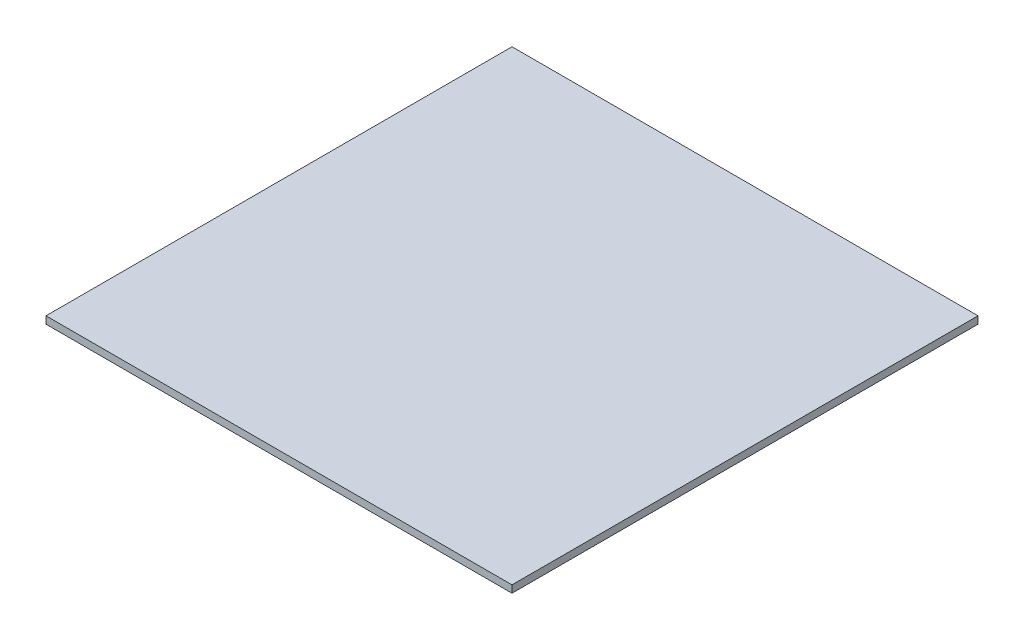
from build123d import *

# Parameters (mm, degrees)
SKETCH1_W           = 812.8
SKETCH1_H           = 812.8
BOSS_EXTRUDE1_DEPTH = 12.7


with BuildPart() as part:
    # Sketch1 → Boss-Extrude1 (new body)
    with BuildSketch(Plane(origin=(0, 0, 0), x_dir=(1, 0, 0), z_dir=(0, 1, 0))):
        with Locations((406.4, 406.4)):
            Rectangle(SKETCH1_W, SKETCH1_H)
    extrude(amount=BOSS_EXTRUDE1_DEPTH)


solid = part.part
